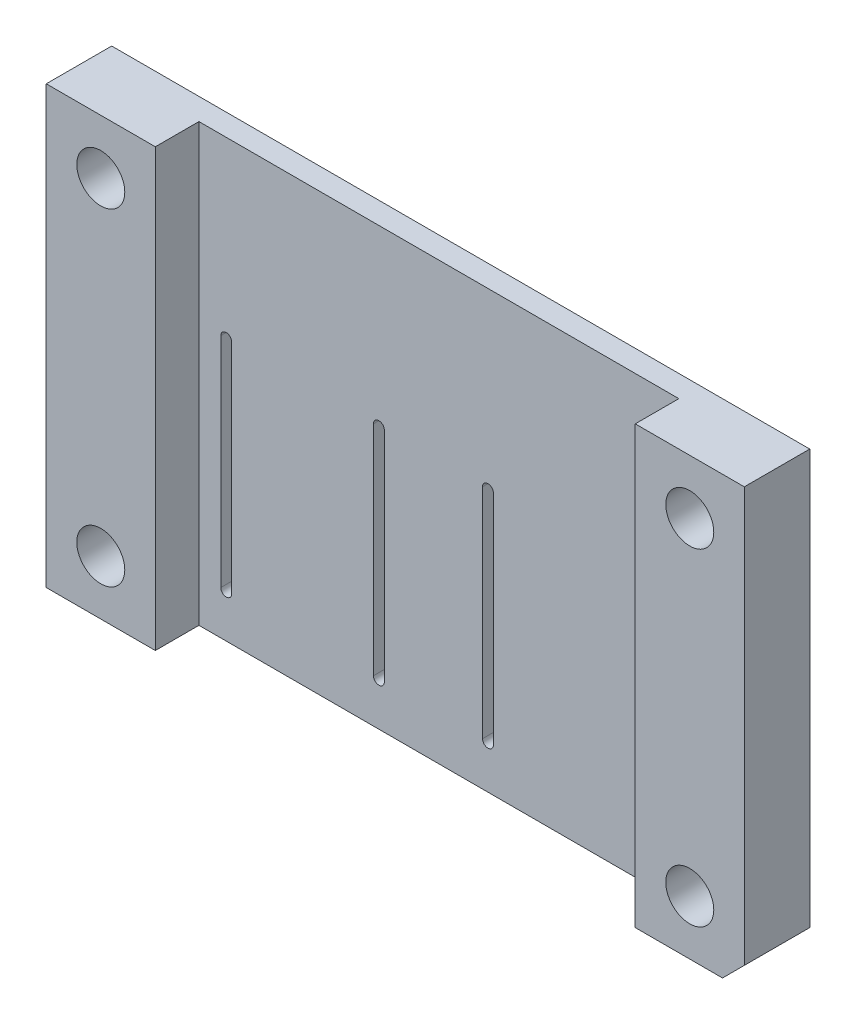
from build123d import *

# Parameters (mm, degrees)
SKETCH1_W           = 320
SKETCH1_H           = 200
SKETCH1_R           = 11
BOSS_EXTRUDE1_DEPTH = 30
CUT_EXTRUDE1_DEPTH  = 379.549864615
SKETCH4_W           = 220
SKETCH4_H           = 200
CUT_EXTRUDE2_DEPTH  = 20
CHAMFER1_SIZE       = 10


with BuildPart() as part:
    # Sketch1 → Boss-Extrude1 (new body)
    with BuildSketch(Plane.XY):
        with Locations((160, 100)):
            Rectangle(SKETCH1_W, SKETCH1_H)
        with Locations((25, 175)):
            Circle(SKETCH1_R, mode=Mode.SUBTRACT)
        with Locations((295, 175)):
            Circle(SKETCH1_R, mode=Mode.SUBTRACT)
        with Locations((25, 25)):
            Circle(SKETCH1_R, mode=Mode.SUBTRACT)
        with Locations((295, 25)):
            Circle(SKETCH1_R, mode=Mode.SUBTRACT)
    extrude(amount=BOSS_EXTRUDE1_DEPTH)

    # Sketch2 → Cut-Extrude1 (cut, through all)
    with BuildSketch(Plane.XY.offset(30)):
        with BuildLine():
            Line((260, 120), (260, 20))
            ThreePointArc((260, 20), (257.5, 17.5), (255, 20))
            Line((255, 20), (255, 120))
            ThreePointArc((255, 120), (257.5, 122.5), (260, 120))
        make_face()
        with BuildLine():
            Line((185, 120), (185, 20))
            ThreePointArc((185, 20), (182.5, 17.5), (180, 20))
            Line((180, 20), (180, 120))
            ThreePointArc((180, 120), (182.5, 122.5), (185, 120))
        make_face()
        with BuildLine():
            Line((65, 120), (65, 20))
            ThreePointArc((65, 20), (62.5, 17.5), (60, 20))
            Line((60, 20), (60, 120))
            ThreePointArc((60, 120), (62.5, 122.5), (65, 120))
        make_face()
        with BuildLine():
            Line((135, 120), (135, 20))
            ThreePointArc((135, 20), (132.5, 17.5), (130, 20))
            Line((130, 20), (130, 120))
            ThreePointArc((130, 120), (132.5, 122.5), (135, 120))
        make_face()
    extrude(amount=-CUT_EXTRUDE1_DEPTH, mode=Mode.SUBTRACT)

    # Sketch4 → Cut-Extrude2 (cut)
    with BuildSketch(Plane.XY.offset(30)):
        with Locations((160, 100)):
            Rectangle(SKETCH4_W, SKETCH4_H)
    extrude(amount=-CUT_EXTRUDE2_DEPTH, mode=Mode.SUBTRACT)

    # Chamfer1
    chamfer1_edges = [part.edges().sort_by_distance(p)[0] for p in [
        (320, 0, 15),
    ]]
    chamfer(chamfer1_edges, length=CHAMFER1_SIZE)


solid = part.part
